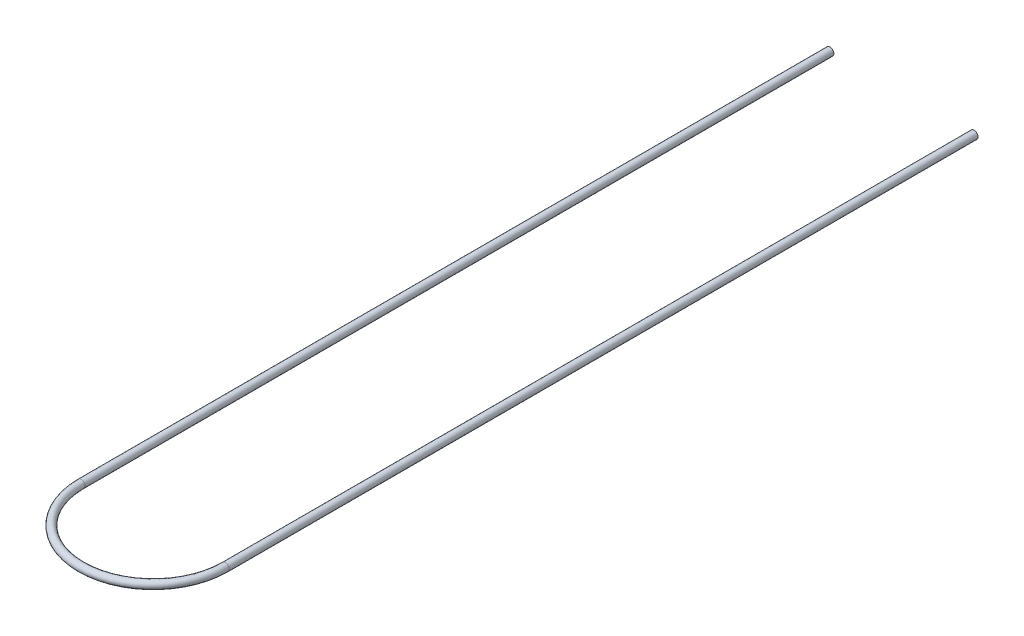
from build123d import *

# Parameters (mm, degrees)
SKETCH2_R   = 11.1
SKETCH2_R_2 = 9.95


with BuildPart() as part:
    # Sweep1: sweep along a path in Sketch1
    with BuildLine(Plane(origin=(0, 0, 0), x_dir=(1, 0, 0), z_dir=(0, 1, 0))) as sweep1_path:
        Line((372, -300), (372, -2440))
        ThreePointArc((372, -2440), (166, -2646), (-40, -2440))
        Line((-40, -2440), (-40, -300))
    # Sketch2 → Sweep1 (sweep)
    with BuildSketch(Plane(origin=(372, 0, 300), x_dir=(-1, 0, 0), z_dir=(0, 0, -1))):
        Circle(SKETCH2_R)
        Circle(SKETCH2_R_2, mode=Mode.SUBTRACT)
    sweep(path=sweep1_path.line)


solid = part.part
